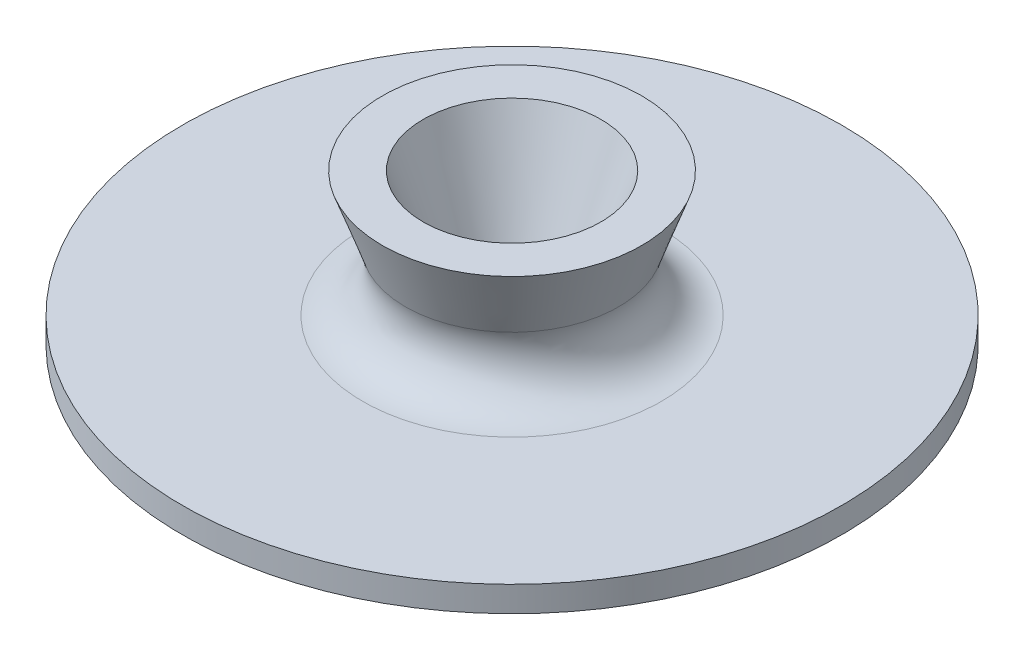
from build123d import *

# Parameters (mm, degrees)
FILLET1_R = 10


with BuildPart() as part:
    # Sketch1 → Revolve1 (revolve)
    with BuildSketch(Plane.XY, mode=Mode.PRIVATE) as revolve1_sk:
        Polygon((-18.744174885, 0), (-72.691581878, 0), (-72.691581878, -5.616084741), (-13.370797043, -5.616084741), (-9.742614484, -15.774995906), (-4.108687375, -15.774995906), (-9.742614484, 0), (-19.607603388, 27.621968933), (-28.609163789, 27.621968933), align=None)
    revolve(revolve1_sk.sketch.rotate(Axis((0, 0, 0), (0, 1, 0)), 270), axis=Axis((0, 0, 0), (0, 1, 0)))

    # Fillet1
    fillet1_edges = [part.edges().sort_by_distance(p)[0] for p in [
        (0, 0, 18.744174885),
    ]]
    fillet(fillet1_edges, radius=FILLET1_R)


solid = part.part
